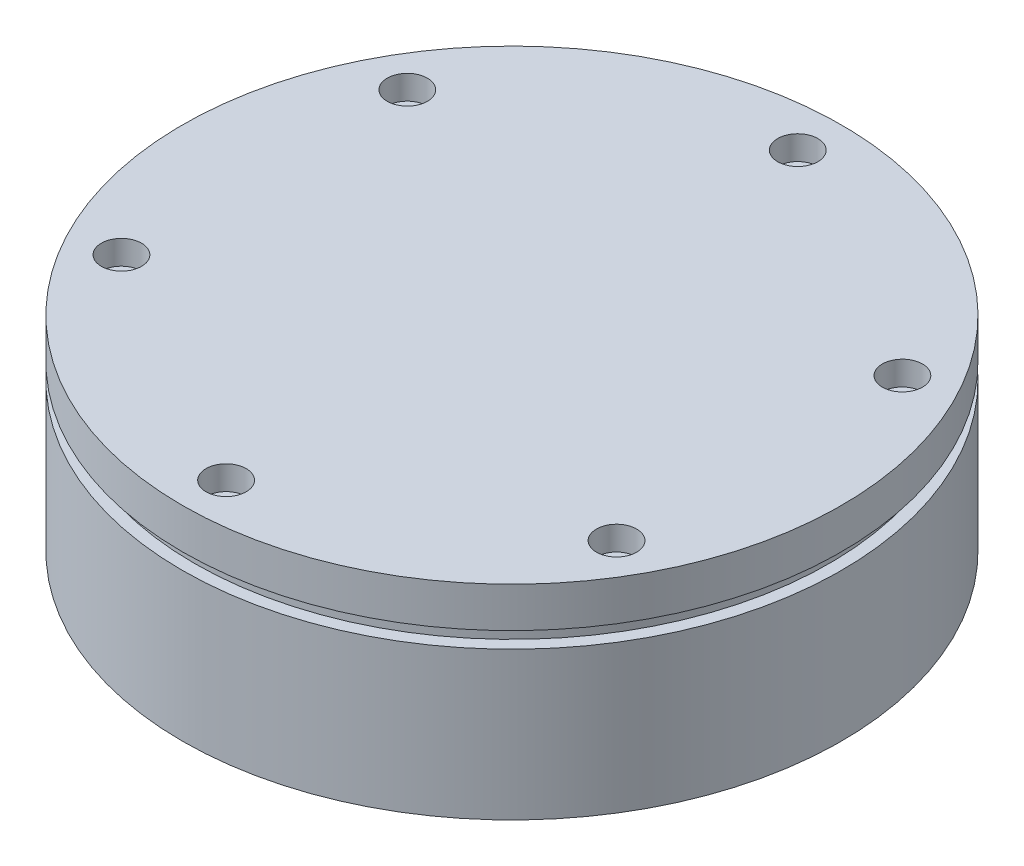
from build123d import *

# Parameters (mm, degrees)
SKETCH1_R           = 41
BOSS_EXTRUDE1_DEPTH = 18.4
SKETCH2_R           = 39.5
BOSS_EXTRUDE2_DEPTH = 2
SKETCH3_R           = 41
BOSS_EXTRUDE3_DEPTH = 5
SKETCH4_R           = 2.5
CUT_EXTRUDE1_DEPTH  = 5
CUT_EXTRUDE2_START  = -3
SKETCH5_R           = 2.5
CUT_EXTRUDE2_DEPTH  = 3


with BuildPart() as part:
    # Sketch1 → Boss-Extrude1 (new body)
    with BuildSketch(Plane(origin=(0, 0, 0), x_dir=(1, 0, 0), z_dir=(0, 1, 0))):
        with Locations(Location((0, 0, 0), (0, 0, 270))):
            Circle(SKETCH1_R)
    extrude(amount=BOSS_EXTRUDE1_DEPTH)

    # Sketch2 → Boss-Extrude2 (add)
    with BuildSketch(Plane(origin=(0, 18.4, 0), x_dir=(1, 0, 0), z_dir=(0, 1, 0))):
        with Locations(Location((0, 0, 0), (0, 0, 270))):
            Circle(SKETCH2_R)
    extrude(amount=BOSS_EXTRUDE2_DEPTH)

    # Sketch3 → Boss-Extrude3 (add)
    with BuildSketch(Plane(origin=(0, 20.4, 0), x_dir=(1, 0, 0), z_dir=(0, 1, 0))):
        with Locations(Location((0, 0, 0), (0, 0, 270))):
            Circle(SKETCH3_R)
    extrude(amount=BOSS_EXTRUDE3_DEPTH)

    # Sketch4 → Cut-Extrude1 (cut)
    with BuildSketch(Plane.XZ):
        with Locations(Location((30.795863359, 17.78, 0), (0, 0, 270))):
            Circle(SKETCH4_R)
        with Locations(Location((30.795863359, -17.78, 0), (0, 0, 270))):
            Circle(SKETCH4_R)
        with Locations(Location((0, -35.56, 0), (0, 0, 270))):
            Circle(SKETCH4_R)
        with Locations(Location((-30.795863359, -17.78, 0), (0, 0, 270))):
            Circle(SKETCH4_R)
        with Locations(Location((-30.795863359, 17.78, 0), (0, 0, 270))):
            Circle(SKETCH4_R)
        with Locations(Location((0, 35.56, 0), (0, 0, 270))):
            Circle(SKETCH4_R)
    extrude(amount=-CUT_EXTRUDE1_DEPTH, mode=Mode.SUBTRACT)

    # Sketch5 → Cut-Extrude2 (cut)
    with BuildSketch(Plane(origin=(0, 25.4, 0), x_dir=(1, 0, 0), z_dir=(0, 1, 0)).offset(CUT_EXTRUDE2_START)):
        with Locations(Location((30.795863359, 17.78, 0), (0, 0, 90))):
            Circle(SKETCH5_R)
        with Locations(Location((30.795863359, -17.78, 0), (0, 0, 90))):
            Circle(SKETCH5_R)
        with Locations(Location((0, -35.56, 0), (0, 0, 90))):
            Circle(SKETCH5_R)
        with Locations(Location((-30.795863359, -17.78, 0), (0, 0, 90))):
            Circle(SKETCH5_R)
        with Locations(Location((-30.795863359, 17.78, 0), (0, 0, 90))):
            Circle(SKETCH5_R)
        with Locations(Location((0, 35.56, 0), (0, 0, 90))):
            Circle(SKETCH5_R)
    extrude(amount=CUT_EXTRUDE2_DEPTH, mode=Mode.SUBTRACT)


solid = part.part
